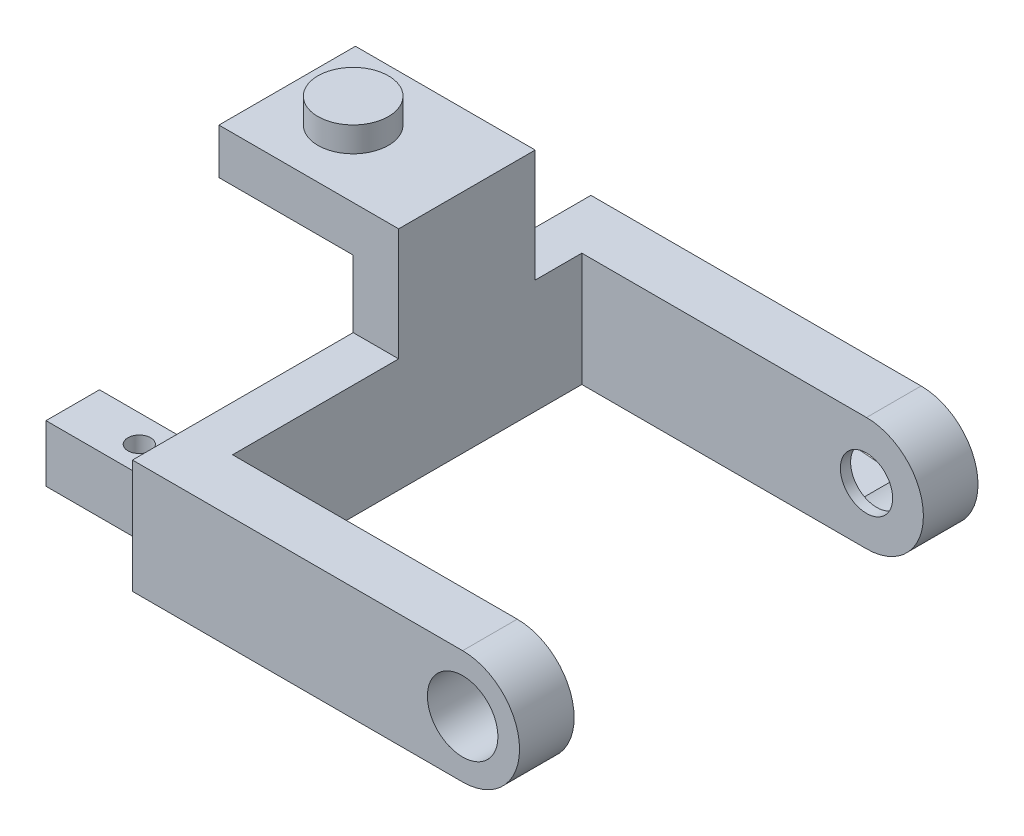
from build123d import *

# Parameters (mm, degrees)
BOSS_EXTRUDE1_DEPTH     = 20.15
CUT_EXTRUDE1_DEPTH      = 40.134529676
CUT_EXTRUDE1_DEPTH_BACK = 40.134529676
CUT_EXTRUDE2_START      = -40.3
CUT_EXTRUDE2_DEPTH      = 3.9
SKETCH5_R               = 2.3
CUT_EXTRUDE3_DEPTH      = 39.164268799
SKETCH6_R               = 3.1
CUT_EXTRUDE4_DEPTH      = 39.164268799
SKETCH7_W               = 11.8
SKETCH7_H               = 4.7
SKETCH7_R               = 1
BOSS_EXTRUDE2_DEPTH     = 5
SKETCH8_W               = 4
SKETCH8_H               = 12
BOSS_EXTRUDE3_DEPTH     = 9.9
SKETCH8_2_W             = 4
SKETCH8_2_H             = 12
BOSS_EXTRUDE4_DEPTH     = 9.9
SKETCH9_W               = 11.8
SKETCH9_H               = 12
BOSS_EXTRUDE5_DEPTH     = 4
SKETCH10_R              = 3.1
BOSS_EXTRUDE6_DEPTH     = 2.2


with BuildPart() as part:
    # Sketch1 → Boss-Extrude1 (new, symmetric)
    with BuildSketch(Plane.XY):
        with BuildLine():
            Line((-27.023255814, 5), (27.023255814, 5))
            ThreePointArc((27.023255814, 5), (32.023255814, 0), (27.023255814, -5))
            Line((27.023255814, -5), (-27.023255814, -5))
            ThreePointArc((-27.023255814, -5), (-32.023255814, 0), (-27.023255814, 5))
        make_face()
    extrude(amount=BOSS_EXTRUDE1_DEPTH, both=True)

    # Sketch2 → Cut-Extrude1 (cut, two sides: drawn at the far end of the back side and taken through both)
    with BuildSketch(Plane(origin=(0, 5, 0), x_dir=(1, 0, 0), z_dir=(0, 1, 0)).offset(-CUT_EXTRUDE1_DEPTH_BACK)):
        Polygon((-2, -20.15), (-2, 20.15), (-27.023255814, 20.15), (-37.952019542, 20.15), (-37.952019542, -20.15), (-27.023255814, -20.15), align=None)
        Polygon((27.023255814, 15.35), (38.05829872, 15.35), (38.05829872, -15.35), (27.023255814, -15.35), (2, -15.35), (2, 15.35), align=None)
    extrude(amount=CUT_EXTRUDE1_DEPTH + CUT_EXTRUDE1_DEPTH_BACK, mode=Mode.SUBTRACT)

    # Sketch4 → Cut-Extrude2 (cut)
    with BuildSketch(Plane.XY.offset(20.15).offset(CUT_EXTRUDE2_START)):
        with BuildLine():
            Line((25.123749299, 2.85), (12.848255814, 1.9))
            ThreePointArc((12.848255814, 1.9), (10.948255814, 0), (12.848255814, -1.9))
            Line((12.848255814, -1.9), (25.123749299, -2.85))
            ThreePointArc((25.123749299, -2.85), (30.448255814, 0), (25.123749299, 2.85))
        make_face()
    extrude(amount=CUT_EXTRUDE2_DEPTH, mode=Mode.SUBTRACT)

    # Sketch5 → Cut-Extrude3 (cut, through all)
    with BuildSketch(Plane.XY):
        with Locations((27.023255814, 0)):
            Circle(SKETCH5_R)
    extrude(amount=-CUT_EXTRUDE3_DEPTH, mode=Mode.SUBTRACT)

    # Sketch6 → Cut-Extrude4 (cut, through all)
    with BuildSketch(Plane.XY):
        with Locations((27.023255814, 0)):
            Circle(SKETCH6_R)
    extrude(amount=CUT_EXTRUDE4_DEPTH, mode=Mode.SUBTRACT)

    # Sketch7 → Boss-Extrude2 (add)
    # profile 1 of 2: a face of its own
    with BuildSketch(Plane(origin=(0, 0, 0), x_dir=(1, 0, 0), z_dir=(0, 1, 0))):
        with Locations((-7.9, 13.6)):
            Rectangle(SKETCH7_W, SKETCH7_H)
        with Locations(Location((-7.9, 13.55, 0), (0, 0, 270))):
            Circle(SKETCH7_R, mode=Mode.SUBTRACT)
    # profile 2 of 2: a face of its own
    with BuildSketch(Plane(origin=(0, 0, 0), x_dir=(1, 0, 0), z_dir=(0, 1, 0))):
        with Locations((-7.9, -13.6)):
            Rectangle(SKETCH7_W, SKETCH7_H)
        with Locations(Location((-7.9, -13.65, 0), (0, 0, 270))):
            Circle(SKETCH7_R, mode=Mode.SUBTRACT)
    extrude(amount=-BOSS_EXTRUDE2_DEPTH)

    # Sketch8 → Boss-Extrude3 (add)
    with BuildSketch(Plane(origin=(0, 5, 0), x_dir=(1, 0, 0), z_dir=(0, 1, 0))):
        with Locations((0, 5.25)):
            Rectangle(SKETCH8_W, SKETCH8_H)
    extrude(amount=BOSS_EXTRUDE3_DEPTH)

    # Sketch8<2> → Boss-Extrude4 (add)
    with BuildSketch(Plane(origin=(0, 5, 0), x_dir=(1, 0, 0), z_dir=(0, 1, 0))):
        with Locations((0, 5.25)):
            Rectangle(SKETCH8_2_W, SKETCH8_2_H)
    extrude(amount=BOSS_EXTRUDE4_DEPTH)

    # Sketch9 → Boss-Extrude5 (add)
    with BuildSketch(Plane(origin=(0, 14.9, 0), x_dir=(1, 0, 0), z_dir=(0, 1, 0))):
        with Locations((-7.9, 5.25)):
            Rectangle(SKETCH9_W, SKETCH9_H)
    extrude(amount=-BOSS_EXTRUDE5_DEPTH)

    # Sketch10 → Boss-Extrude6 (add)
    with BuildSketch(Plane(origin=(0, 14.9, 0), x_dir=(1, 0, 0), z_dir=(0, 1, 0))):
        with Locations(Location((-7.9, 5.15, 0), (0, 0, 270))):
            Circle(SKETCH10_R)
    extrude(amount=BOSS_EXTRUDE6_DEPTH)


solid = part.part
